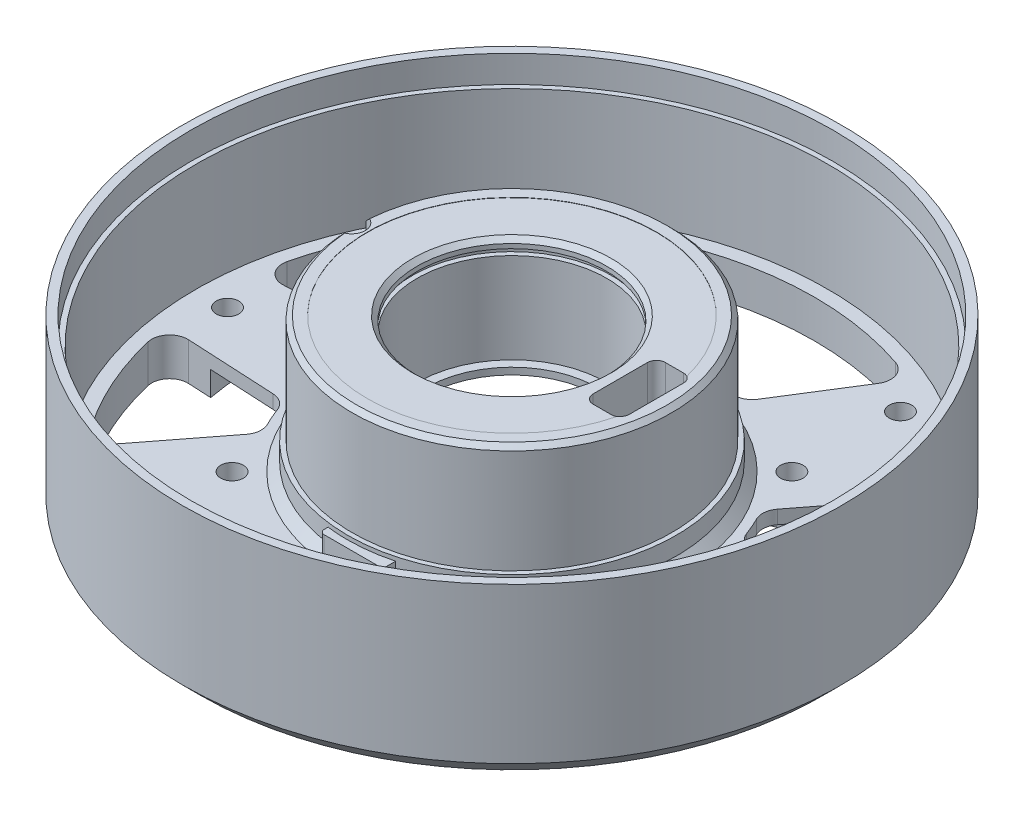
from build123d import *

# Parameters (mm, degrees)
CUT_EXTRUDE2_REACH              = 55.28
SKETCH2_R                       = 1.5
CUT_EXTRUDE2_DIRECTION_2_REACH  = 55.28
BOSS_EXTRUDE1_START             = -10.5
SKETCH3_R                       = 3.5
BOSS_EXTRUDE1_DEPTH             = 1.5
M3X0_5_TAPPED_HOLE1_D           = 2.5
M3X0_5_TAPPED_HOLE1_CSINK_D     = 3.2
M3X0_5_TAPPED_HOLE1_CSINK_ANGLE = 90
BOSS_EXTRUDE2_START             = -6.44
BOSS_EXTRUDE2_DEPTH             = 4.06
CUT_EXTRUDE5_DEPTH              = 54.279827327
CUT_EXTRUDE5_DEPTH_BACK         = 54.279827327
CHAMFER1_SIZE                   = 0.5
M3X0_5_TAPPED_HOLE2_D           = 2.5
M3X0_5_TAPPED_HOLE2_CSINK_D     = 3.2
M3X0_5_TAPPED_HOLE2_CSINK_ANGLE = 90
CIRPATTERN2_COUNT               = 6
CUT_EXTRUDE6_DEPTH              = 54.279827327


with BuildPart() as part:
    # Sketch1 → Revolve1 (revolve)
    with BuildSketch(Plane.XY, mode=Mode.PRIVATE) as revolve1_sk:
        Polygon((-17.7, 6), (-17.7, -6), (-18.2, -6), (-18.2, -8), (-19.2, -9), (-35, -9), (-35, 3), (-35.55, 3), (-35.55, 6), (-36.5, 6), (-36.5, -11.2), (-34.5, -13.2), (-28.5, -13.2), (-28.5, -10.5), (-18.06, -10.5), (-14, -6.44), (-9.5, -6.44), (-9.5, -5.69), (-10.5, -5.69), (-10.5, 4.31), (-11.03, 4.31), (-11.03, 4.97), (-10.5, 4.97), (-10.5, 5.97), (-16, 5.97), (-16, 6), align=None)
    revolve(revolve1_sk.sketch.rotate(Axis((0, 0, 0), (0, -1, 0)), 270), axis=Axis((0, 0, 0), (0, -1, 0)))

    # Sketch2 → Cut-Extrude2 (cut, up to next)
    with BuildSketch(Plane(origin=(0, 0, 0), x_dir=(1, 0, 0), z_dir=(0, 1, 0)), mode=Mode.PRIVATE) as cut_extrude2_sk1:
        with Locations((-17.75, 0)):
            Circle(SKETCH2_R)
    cut_extrude2_tool1 = extrude(cut_extrude2_sk1.sketch, amount=CUT_EXTRUDE2_REACH, mode=Mode.PRIVATE) & part.part
    add(cut_extrude2_tool1.solids().sort_by_distance((-17.75, 0, 0))[0], mode=Mode.SUBTRACT)

    # Cut-Extrude2 direction 2: up to this face of the body (flat: up to its plane)
    cut_extrude2_direction_2_end = Plane(part.part.faces().sort_by_distance((0, -6, -17.751477374))[0])
    # Sketch2 → Cut-Extrude2 direction 2 (cut, up to the picked face)
    with BuildSketch(Plane(origin=(0, 0, 0), x_dir=(1, 0, 0), z_dir=(0, 1, 0)), mode=Mode.PRIVATE) as cut_extrude2_direction_2_sk1:
        with Locations((-17.75, 0)):
            Circle(SKETCH2_R)
    cut_extrude2_direction_2_tool1 = split(extrude(cut_extrude2_direction_2_sk1.sketch, amount=-CUT_EXTRUDE2_DIRECTION_2_REACH, mode=Mode.PRIVATE), bisect_by=cut_extrude2_direction_2_end, keep=Keep.BOTH, mode=Mode.PRIVATE)
    add(cut_extrude2_direction_2_tool1.solids().sort_by(Axis((-17.75, 0, 0), (0, -1, 0)))[0], mode=Mode.SUBTRACT)

    # Sketch3 → Boss-Extrude1 (add)
    with BuildSketch(Plane(origin=(0, 0, 0), x_dir=(1, 0, 0), z_dir=(0, 1, 0)).offset(BOSS_EXTRUDE1_START)):
        with Locations(Location((-15.5, -15.5, 0), (0, 0, 270))):
            Circle(SKETCH3_R)
        with Locations(Location((15.5, -15.5, 0), (0, 0, 270))):
            Circle(SKETCH3_R)
        with Locations(Location((15.5, 15.5, 0), (0, 0, 270))):
            Circle(SKETCH3_R)
        with Locations(Location((-15.5, 15.5, 0), (0, 0, 270))):
            Circle(SKETCH3_R)
    extrude(amount=-BOSS_EXTRUDE1_DEPTH)

    # M3x0.5 Tapped Hole1 (through all)
    with Locations(Plane(origin=(0, -12, 0), x_dir=(-1, 0, 0), z_dir=(0, -1, 0))):
        with Locations((-15.5, 15.5), (15.5, 15.5), (15.5, -15.5), (-15.5, -15.5)):
            CounterSinkHole(M3X0_5_TAPPED_HOLE1_D / 2, M3X0_5_TAPPED_HOLE1_CSINK_D / 2, counter_sink_angle=M3X0_5_TAPPED_HOLE1_CSINK_ANGLE)

    # Sketch7 → Boss-Extrude2 (add)
    with BuildSketch(Plane(origin=(0, 0, 0), x_dir=(1, 0, 0), z_dir=(0, 1, 0)).offset(BOSS_EXTRUDE2_START)):
        with BuildLine():
            Line((-1.8, -19), (4.2, -19))
            ThreePointArc((4.2, -19), (4.553553391, -18.853553391), (4.7, -18.5))
            Line((4.7, -18.5), (4.7, -12.5))
            ThreePointArc((4.7, -12.5), (4.553553391, -12.146446609), (4.2, -12))
            Line((4.2, -12), (-1.8, -12))
            ThreePointArc((-1.8, -12), (-2.153553391, -12.146446609), (-2.3, -12.5))
            Line((-2.3, -12.5), (-2.3, -18.5))
            ThreePointArc((-2.3, -18.5), (-2.153553391, -18.853553391), (-1.8, -19))
        make_face()
    extrude(amount=-BOSS_EXTRUDE2_DEPTH)

    # Sketch10 → Cut-Extrude5 (cut, two sides: drawn at the far end of the back side and taken through both)
    with BuildSketch(Plane(origin=(0, 0, 0), x_dir=(1, 0, 0), z_dir=(0, 1, 0)).offset(-CUT_EXTRUDE5_DEPTH_BACK)):
        with BuildLine():
            Line((13, 4), (15, 4))
            ThreePointArc((15, 4), (15.707106781, 3.707106781), (16, 3))
            Line((16, 3), (16, -3))
            ThreePointArc((16, -3), (15.707106781, -3.707106781), (15, -4))
            Line((15, -4), (13, -4))
            ThreePointArc((13, -4), (12.292893219, -3.707106781), (12, -3))
            Line((12, -3), (12, 3))
            ThreePointArc((12, 3), (12.292893219, 3.707106781), (13, 4))
        make_face()
    extrude(amount=CUT_EXTRUDE5_DEPTH + CUT_EXTRUDE5_DEPTH_BACK, mode=Mode.SUBTRACT)

    # Chamfer1
    chamfer1_edges = [part.edges().sort_by_distance(p)[0] for p in [
        (0, 5.97, -10.5),
        (17.7, 6, 0),
    ]]
    chamfer(chamfer1_edges, length=CHAMFER1_SIZE)

    # M3x0.5 Tapped Hole2 (through all)
    with Locations(Plane(origin=(0, -13.2, 0), x_dir=(-1, 0, 0), z_dir=(0, -1, 0))):
        with Locations((-31.5, 0)):
            m3x0_5_tapped_hole2 = CounterSinkHole(M3X0_5_TAPPED_HOLE2_D / 2, M3X0_5_TAPPED_HOLE2_CSINK_D / 2, counter_sink_angle=M3X0_5_TAPPED_HOLE2_CSINK_ANGLE)

    # CirPattern2: M3x0.5 Tapped Hole2 ×6 about axis
    cirpattern2_axis = Axis((0, 0, 0), (0, 1, 0))
    for i in range(1, CIRPATTERN2_COUNT):
        add(m3x0_5_tapped_hole2.rotate(cirpattern2_axis, i * 360 / CIRPATTERN2_COUNT), mode=Mode.SUBTRACT)

    # Sketch13 → Cut-Extrude6 (cut, through all)
    with BuildSketch(Plane(origin=(0, 0, 0), x_dir=(1, 0, 0), z_dir=(0, 1, 0))):
        with BuildLine():
            Line((-11.819974353, 28.763526297), (-6.670304659, 20.570592469))
            ThreePointArc((-6.670304659, 20.570592469), (-5.740661898, 19.786439026), (-4.52863556, 19.685818753))
            ThreePointArc((-4.52863556, 19.685818753), (0, 20.2), (4.52863556, 19.685818753))
            ThreePointArc((4.52863556, 19.685818753), (5.740661898, 19.786439026), (6.670304659, 20.570592469))
            Line((6.670304659, 20.570592469), (11.819974353, 28.763526297))
            ThreePointArc((11.819974353, 28.763526297), (12.011408024, 30.49703647), (10.769649139, 31.721674883))
            ThreePointArc((10.769649139, 31.721674883), (0, 33.5), (-10.769649139, 31.721674883))
            ThreePointArc((-10.769649139, 31.721674883), (-12.011408024, 30.49703647), (-11.819974353, 28.763526297))
        make_face()
        with BuildLine():
            Line((11.819974353, -28.763526297), (6.670304659, -20.570592469))
            ThreePointArc((6.670304659, -20.570592469), (5.740661898, -19.786439026), (4.52863556, -19.685818753))
            ThreePointArc((4.52863556, -19.685818753), (0, -20.2), (-4.52863556, -19.685818753))
            ThreePointArc((-4.52863556, -19.685818753), (-5.740661898, -19.786439026), (-6.670304659, -20.570592469))
            Line((-6.670304659, -20.570592469), (-11.819974353, -28.763526297))
            ThreePointArc((-11.819974353, -28.763526297), (-12.011408024, -30.49703647), (-10.769649139, -31.721674883))
            ThreePointArc((-10.769649139, -31.721674883), (0, -33.5), (10.769649139, -31.721674883))
            ThreePointArc((10.769649139, -31.721674883), (12.011408024, -30.49703647), (11.819974353, -28.763526297))
        make_face()
        with BuildLine():
            Line((18.292189746, 11.114257593), (24.405285387, 19.024273252))
            ThreePointArc((24.405285387, 19.024273252), (26.045143246, 19.800453792), (27.637794484, 18.931516475))
            ThreePointArc((27.637794484, 18.931516475), (30.638576975, 13.547235915), (32.60205225, 7.704296796))
            ThreePointArc((32.60205225, 7.704296796), (32.191641003, 5.963415031), (30.552788829, 5.246986205))
            Line((30.552788829, 5.246986205), (20.699757571, 5.75445966))
            ThreePointArc((20.699757571, 5.75445966), (19.619853436, 6.139038212), (18.928519018, 7.053450771))
            ThreePointArc((18.928519018, 7.053450771), (18.531923602, 8.037898207), (18.084169437, 9.00015643))
            ThreePointArc((18.084169437, 9.00015643), (17.884293407, 10.087108371), (18.292189746, 11.114257593))
        make_face()
        with BuildLine():
            Line((30.552788829, -5.246986205), (20.699757571, -5.75445966))
            ThreePointArc((20.699757571, -5.75445966), (19.619853436, -6.139038212), (18.928519018, -7.053450771))
            ThreePointArc((18.928519018, -7.053450771), (18.531923602, -8.037898207), (18.084169437, -9.00015643))
            ThreePointArc((18.084169437, -9.00015643), (17.884293407, -10.087108371), (18.292189746, -11.114257593))
            Line((18.292189746, -11.114257593), (24.405285387, -19.024273252))
            ThreePointArc((24.405285387, -19.024273252), (26.045143246, -19.800453792), (27.637794484, -18.931516475))
            ThreePointArc((27.637794484, -18.931516475), (30.638576975, -13.547235915), (32.60205225, -7.704296796))
            ThreePointArc((32.60205225, -7.704296796), (32.191641003, -5.963415031), (30.552788829, -5.246986205))
        make_face()
        with BuildLine():
            Line((-18.292189746, -11.114257593), (-24.405285387, -19.024273252))
            ThreePointArc((-24.405285387, -19.024273252), (-26.045143246, -19.800453792), (-27.637794484, -18.931516475))
            ThreePointArc((-27.637794484, -18.931516475), (-30.638576975, -13.547235915), (-32.60205225, -7.704296796))
            ThreePointArc((-32.60205225, -7.704296796), (-32.191641003, -5.963415031), (-30.552788829, -5.246986205))
            Line((-30.552788829, -5.246986205), (-20.699757571, -5.75445966))
            ThreePointArc((-20.699757571, -5.75445966), (-19.619853436, -6.139038212), (-18.928519018, -7.053450771))
            ThreePointArc((-18.928519018, -7.053450771), (-18.531923602, -8.037898207), (-18.084169437, -9.00015643))
            ThreePointArc((-18.084169437, -9.00015643), (-17.884293407, -10.087108371), (-18.292189746, -11.114257593))
        make_face()
        with BuildLine():
            Line((-30.552788829, 5.246986205), (-20.699757571, 5.75445966))
            ThreePointArc((-20.699757571, 5.75445966), (-19.619853436, 6.139038212), (-18.928519018, 7.053450771))
            ThreePointArc((-18.928519018, 7.053450771), (-18.531923602, 8.037898207), (-18.084169437, 9.00015643))
            ThreePointArc((-18.084169437, 9.00015643), (-17.884293407, 10.087108371), (-18.292189746, 11.114257593))
            Line((-18.292189746, 11.114257593), (-24.405285387, 19.024273252))
            ThreePointArc((-24.405285387, 19.024273252), (-26.045143246, 19.800453792), (-27.637794484, 18.931516475))
            ThreePointArc((-27.637794484, 18.931516475), (-30.638576975, 13.547235915), (-32.60205225, 7.704296796))
            ThreePointArc((-32.60205225, 7.704296796), (-32.191641003, 5.963415031), (-30.552788829, 5.246986205))
        make_face()
    extrude(amount=-CUT_EXTRUDE6_DEPTH, mode=Mode.SUBTRACT)


solid = part.part
